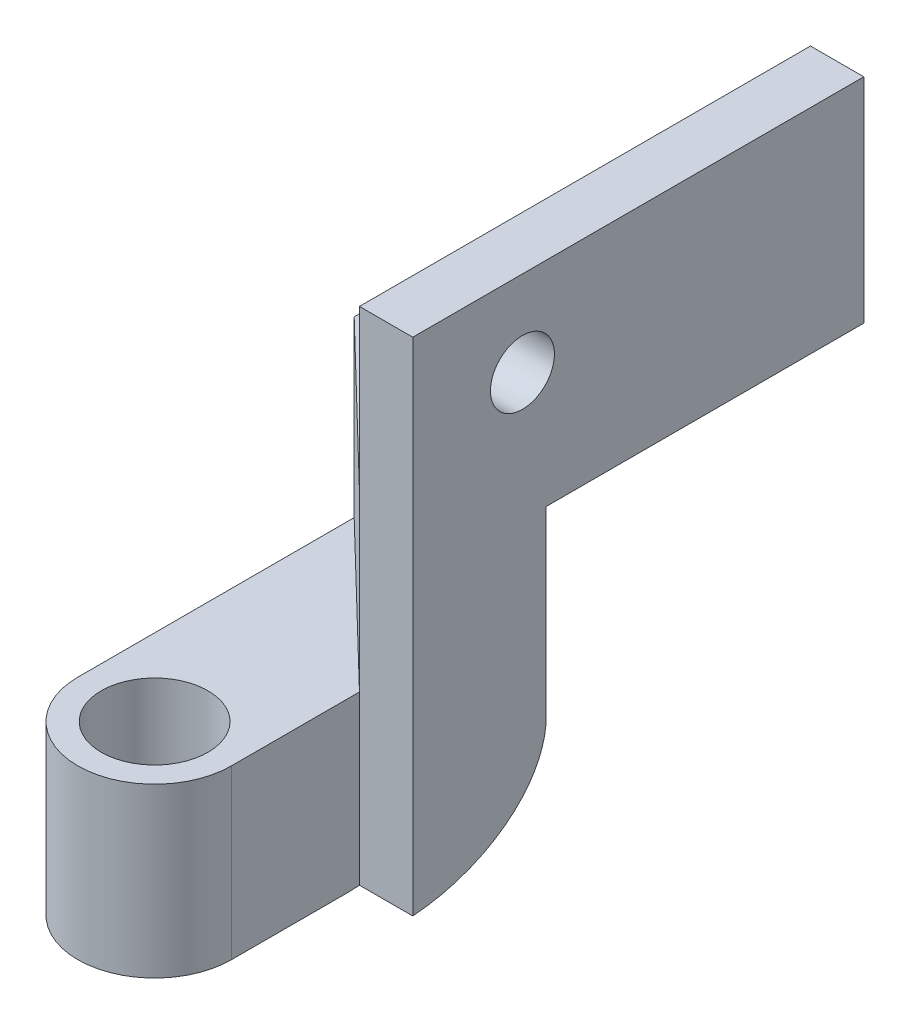
from build123d import *

# Parameters (mm, degrees)
CROQUIS1_R              = 1.5
SALIENTE_EXTRUIR1_DEPTH = 2.5
SALIENTE_EXTRUIR2_START = -8.15
CROQUIS1_4_R            = 2.5
SALIENTE_EXTRUIR2_DEPTH = 7.87
SALIENTE_EXTRUIR3_DEPTH = 16.02
REDONDEO1_R             = 5
CROQUIS3_W              = 21.14
CROQUIS3_H              = 7.5
CROQUIS3_R              = 1.5
SALIENTE_EXTRUIR4_DEPTH = 2.5


with BuildPart() as part:
    # Croquis1 → Saliente-Extruir1 (new body)
    with BuildSketch(Plane(origin=(0, 0, 0), x_dir=(1, 0, 0), z_dir=(0, 1, 0))):
        Polygon((3.6, 27.14), (-3.6, 27.14), (-3.6, 12.952959179), (3.6, 6), align=None)
        with Locations(Location((-0.4, 21.14, 0), (0, 0, 270))):
            Circle(CROQUIS1_R, mode=Mode.SUBTRACT)
    extrude(amount=-SALIENTE_EXTRUIR1_DEPTH)



with BuildPart() as body_2:
    # Croquis1<4> → Saliente-Extruir2 (new body)
    with BuildSketch(Plane(origin=(0, 0, 0), x_dir=(1, 0, 0), z_dir=(0, 1, 0)).offset(SALIENTE_EXTRUIR2_START)):
        with BuildLine():
            Line((3.6, 6), (-3.6, 12.952959179))
            Line((-3.6, 12.952959179), (-3.6, 0))
            ThreePointArc((-3.6, 0), (0, -3.6), (3.6, 0))
            Line((3.6, 0), (3.6, 6))
        make_face()
        with Locations(Location((0, 0, 0), (0, 0, 270))):
            Circle(CROQUIS1_4_R, mode=Mode.SUBTRACT)
    extrude(amount=-SALIENTE_EXTRUIR2_DEPTH)


with BuildPart() as part_1:
    add(part.part)

    add(body_2.part)  # Saliente-Extruir3 merges body 2
    # Croquis1<5> → Saliente-Extruir3 (add)
    with BuildSketch(Plane(origin=(0, 0, 0), x_dir=(1, 0, 0), z_dir=(0, 1, 0))):
        Polygon((-2.286227518, 17.94), (-3.6, 17.94), (-3.6, 12.952959179), (3.6, 6), (3.6, 12.25573616), align=None)
    extrude(amount=-SALIENTE_EXTRUIR3_DEPTH)

    # Redondeo1
    redondeo1_edges = [part_1.edges().sort_by_distance(p)[0] for p in [
        (0.656886241, -16.02, -15.09786808),
    ]]
    fillet(redondeo1_edges, radius=REDONDEO1_R)

    # Croquis3 → Saliente-Extruir4 (add)
    # profile 1 of 2: a face of its own
    with BuildSketch(Plane(origin=(3.6, 0, 0), x_dir=(0, 0, -1), z_dir=(1, 0, 0))):
        with BuildLine():
            Line((6, 0), (6, -8.15))
            Line((6, -8.15), (6, -15.994937186))
            add(Edge.make_bspline(
                [(6, -15.994937186), (12.25573616, -15.542670169), (12.25573616, -11.02)],
                knots=[4.821475205, 4.821475205, 4.821475205, 6.283185307, 6.283185307, 6.283185307], degree=2, weights=[0.962144349, 0.727447175, 1]))
            Line((12.25573616, -11.02), (12.25573616, -2.5))
            Line((12.25573616, -2.5), (27.14, -2.5))
            Line((27.14, -2.5), (27.14, 0))
            Line((27.14, 0), (6, 0))
        make_face()
    # profile 2 of 2: a face of its own
    with BuildSketch(Plane(origin=(3.6, 0, 0), x_dir=(0, 0, -1), z_dir=(1, 0, 0))):
        with Locations((16.57, 3.75)):
            Rectangle(CROQUIS3_W, CROQUIS3_H)
        with Locations((11.14, 3.5)):
            Circle(CROQUIS3_R, mode=Mode.SUBTRACT)
    extrude(amount=SALIENTE_EXTRUIR4_DEPTH)


solid = part_1.part
